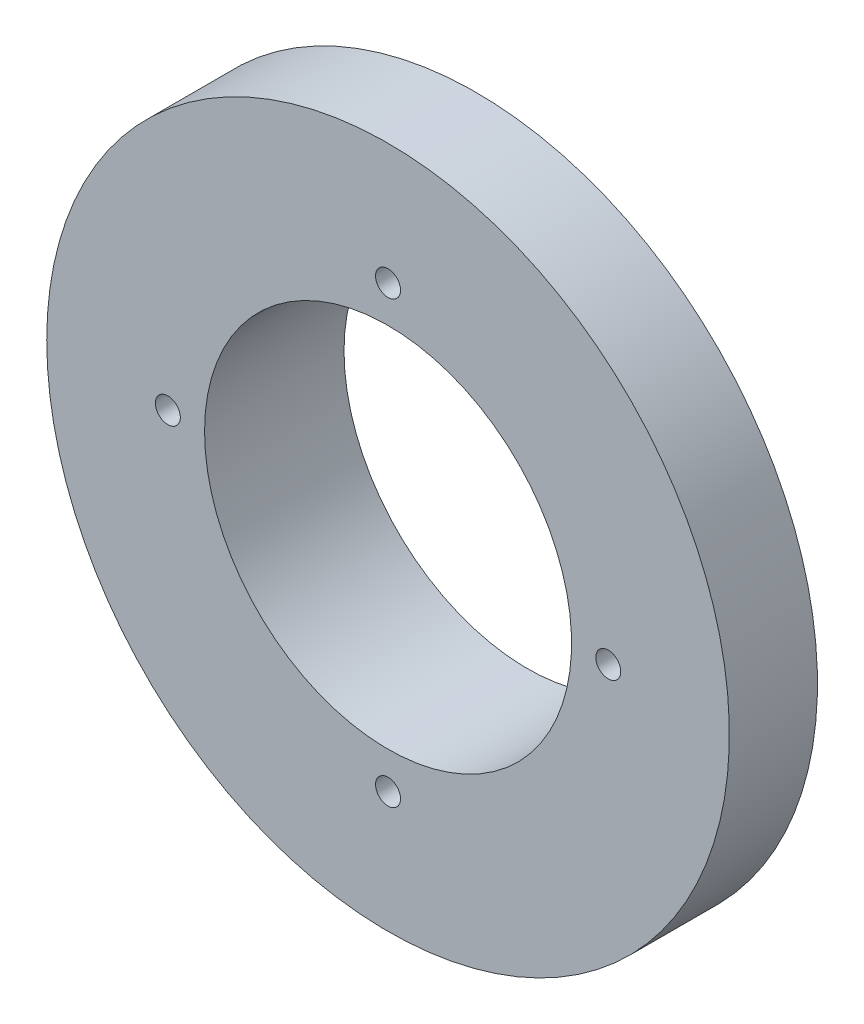
from build123d import *

# Parameters (mm, degrees)
SKETCH1_R          = 1.7
CUT_EXTRUDE1_DEPTH = 69.450712195
CIRPATTERN1_COUNT  = 4


with BuildPart() as part:
    # Croquis2 → Revolución1 (revolve)
    with BuildSketch(Plane(origin=(0, 0, 0), x_dir=(1, 0, 0), z_dir=(0, 1, 0)), mode=Mode.PRIVATE) as revoluci_n1_sk:
        Polygon((25, -19), (25, 0), (35, 0), (35, -7), (46.5, -7), (46.5, -19), align=None)
    revolve(revoluci_n1_sk.sketch.rotate(Axis((0, 0, -25.844178122), (0, 0, 1)), 180), axis=Axis((0, 0, -25.844178122), (0, 0, 1)))

    # Sketch1 → Cut-Extrude1 (cut, symmetric)
    with BuildSketch(Plane.XY.offset(19)):
        with Locations((0, 30)):
            Circle(SKETCH1_R)
    cut_extrude1 = extrude(amount=CUT_EXTRUDE1_DEPTH, both=True, mode=Mode.SUBTRACT)

    # CirPattern1: Cut-Extrude1 ×4 about axis
    cirpattern1_axis = Axis((0, 0, 0), (0, 0, 1))
    for i in range(1, CIRPATTERN1_COUNT):
        add(cut_extrude1.rotate(cirpattern1_axis, i * 360 / CIRPATTERN1_COUNT), mode=Mode.SUBTRACT)


solid = part.part
